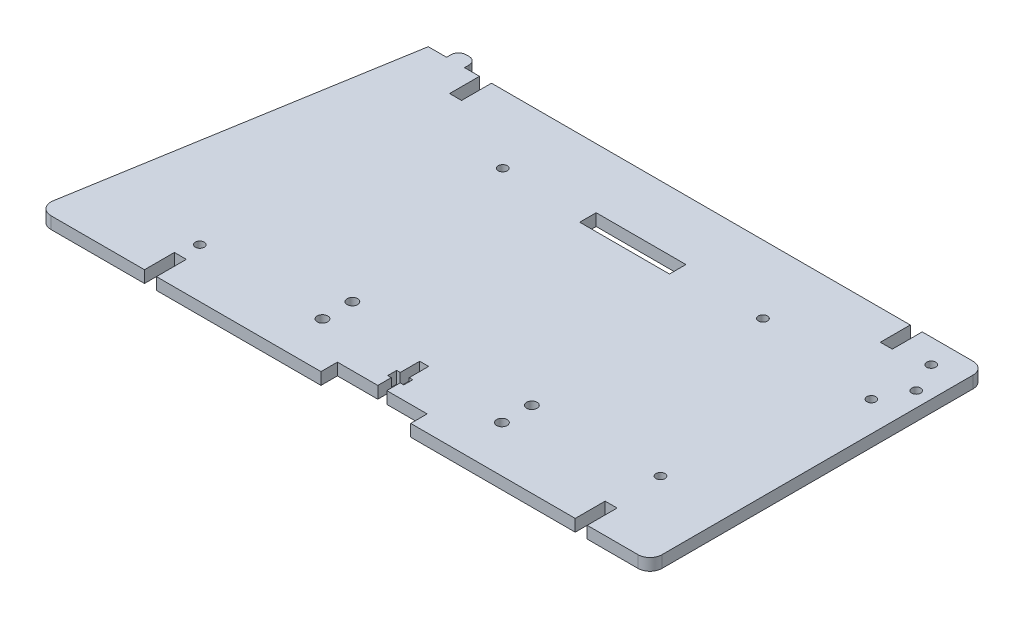
from build123d import *

# Parameters (mm, degrees)
SKETCH1_R           = 1.5
SKETCH1_R_2         = 1.75
SKETCH1_W           = 30
SKETCH1_H           = 5.5
BOSS_EXTRUDE1_DEPTH = 4
FILLET1_R           = 4
FILLET2_R           = 4
FILLET3_R           = 4
FILLET4_R           = 2.5


with BuildPart() as part:
    # Sketch1 → Boss-Extrude1 (new body)
    with BuildSketch(Plane(origin=(0, 0, 0), x_dir=(1, 0, 0), z_dir=(0, 1, 0))):
        Polygon((158.5, 0), (180, 0), (180, 10), (184, 10), (184, 0), (205, 0), (205, 112), (184, 112), (184, 102), (180, 102), (180, 112), (40, 112), (40, 102), (36, 102), (36, 112), (31, 112), (31, 116), (25, 116), (25, 112), (18.8632, 112), (0, 0), (36, 0), (36, 10), (40, 10), (40, 0), (95, 0), (95, 5.5), (108.5, 5.5), (108.5, 10), (107.3, 10), (107.3, 13), (108.5, 13), (108.5, 19.5), (111.5, 19.5), (111.5, 13), (112.7, 13), (112.7, 10), (111.5, 10), (111.5, 5.5), (125, 5.5), (125, 0), (155.5, 0), align=None)
        with Locations(Location((153.5, 89.25, 0), (0, 0, 270))):
            Circle(SKETCH1_R, mode=Mode.SUBTRACT)
        with Locations(Location((66.5, 89.25, 0), (0, 0, 270))):
            Circle(SKETCH1_R, mode=Mode.SUBTRACT)
        with Locations(Location((195, 104, 0), (0, 0, 270))):
            Circle(SKETCH1_R, mode=Mode.SUBTRACT)
        with Locations(Location((195, 84, 0), (0, 0, 270))):
            Circle(SKETCH1_R, mode=Mode.SUBTRACT)
        with Locations(Location((200, 94, 0), (0, 0, 270))):
            Circle(SKETCH1_R, mode=Mode.SUBTRACT)
        with Locations(Location((80, 15.5, 0), (0, 0, 270))):
            Circle(SKETCH1_R_2, mode=Mode.SUBTRACT)
        with Locations(Location((80, 25.5, 0), (0, 0, 270))):
            Circle(SKETCH1_R_2, mode=Mode.SUBTRACT)
        with Locations(Location((140, 15.5, 0), (0, 0, 270))):
            Circle(SKETCH1_R_2, mode=Mode.SUBTRACT)
        with Locations(Location((140, 25.5, 0), (0, 0, 270))):
            Circle(SKETCH1_R_2, mode=Mode.SUBTRACT)
        with Locations(Location((182, 26.5, 0), (0, 0, 270))):
            Circle(SKETCH1_R, mode=Mode.SUBTRACT)
        with Locations(Location((38, 16.5, 0), (0, 0, 270))):
            Circle(SKETCH1_R, mode=Mode.SUBTRACT)
        with Locations((110, 89.25)):
            Rectangle(SKETCH1_W, SKETCH1_H, mode=Mode.SUBTRACT)
    extrude(amount=BOSS_EXTRUDE1_DEPTH)

    # Fillet1
    fillet1_edges = [part.edges().sort_by_distance(p)[0] for p in [
        (0, 2, 0),
    ]]
    fillet(fillet1_edges, radius=FILLET1_R)

    # Fillet2
    fillet2_edges = [part.edges().sort_by_distance(p)[0] for p in [
        (205, 2, -112),
    ]]
    fillet(fillet2_edges, radius=FILLET2_R)

    # Fillet3
    fillet3_edges = [part.edges().sort_by_distance(p)[0] for p in [
        (205, 2, 0),
    ]]
    fillet(fillet3_edges, radius=FILLET3_R)

    # Fillet4
    fillet4_edges = [part.edges().sort_by_distance(p)[0] for p in [
        (25, 2, -116),
        (31, 2, -116),
    ]]
    fillet(fillet4_edges, radius=FILLET4_R)


solid = part.part
